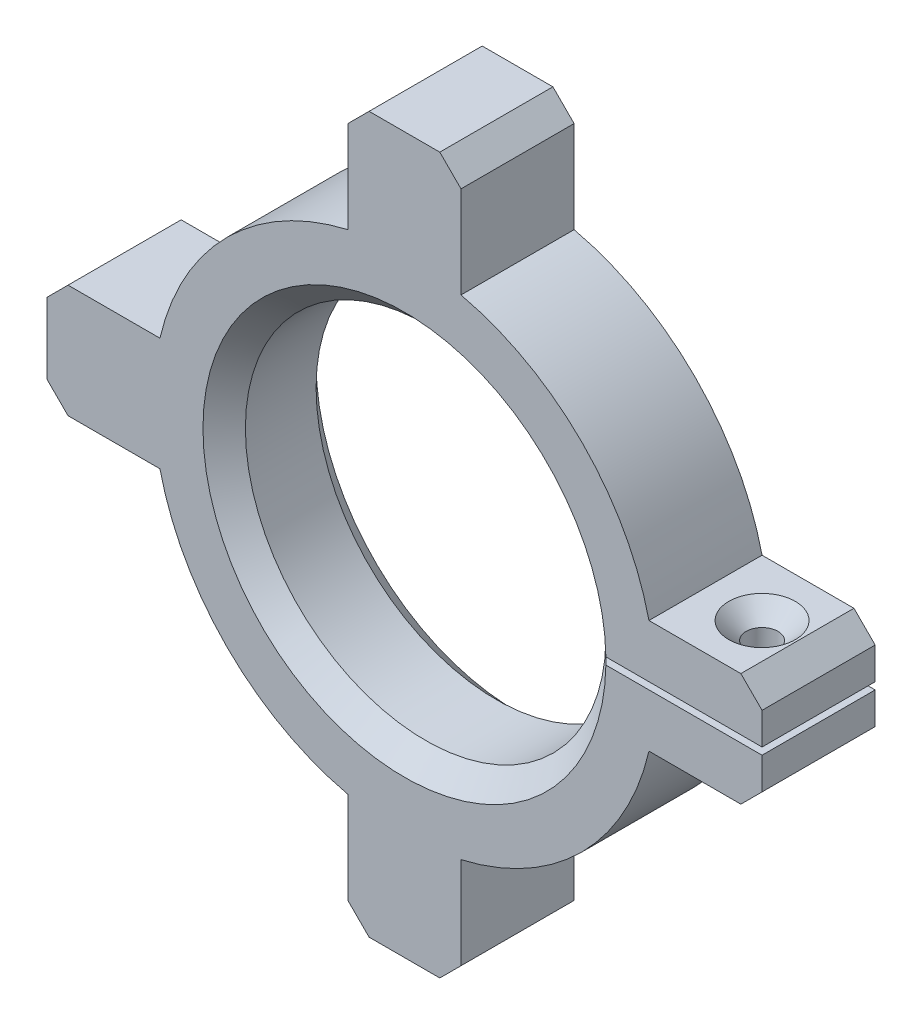
from build123d import *

# Parameters (mm, degrees)
EXTRUDE_1_DEPTH             = 8
HOLE_WIZARD_M41_D           = 4.5
HOLE_WIZARD_M41_CSINK_D     = 9.4
HOLE_WIZARD_M41_CSINK_ANGLE = 90
CUT_EXTRUDE_2_DEPTH         = 5
CHAMFER_1_SIZE              = 3


with BuildPart() as part:
    # Эскиз1 → Бобышка-Вытянуть1 (new, symmetric)
    with BuildSketch(Plane.XY):
        with BuildLine():
            Line((-8, 50.586847211), (8, 50.586847211))
            Line((8, 50.586847211), (8, 34.586847211))
            ThreePointArc((8, 34.586847211), (25.102290732, 25.102290732), (34.586847211, 8))
            Line((34.586847211, 8), (50.586847211, 8))
            Line((50.586847211, 8), (50.586847211, 0.5))
            Line((50.586847211, 0.5), (25.495097568, 0.5))
            ThreePointArc((25.495097568, 0.5), (-25.5, 0), (25.495097568, -0.5))
            Line((25.495097568, -0.5), (50.586847211, -0.5))
            Line((50.586847211, -0.5), (50.586847211, -8))
            Line((50.586847211, -8), (34.586847211, -8))
            ThreePointArc((34.586847211, -8), (25.102290732, -25.102290732), (8, -34.586847211))
            Line((8, -34.586847211), (8, -50.586847211))
            Line((8, -50.586847211), (-8, -50.586847211))
            Line((-8, -50.586847211), (-8, -34.586847211))
            ThreePointArc((-8, -34.586847211), (-25.102290732, -25.102290732), (-34.586847211, -8))
            Line((-34.586847211, -8), (-50.586847211, -8))
            Line((-50.586847211, -8), (-50.586847211, 8))
            Line((-50.586847211, 8), (-34.586847211, 8))
            ThreePointArc((-34.586847211, 8), (-25.102290732, 25.102290732), (-8, 34.586847211))
            Line((-8, 34.586847211), (-8, 50.586847211))
        make_face()
    extrude(amount=EXTRUDE_1_DEPTH, both=True)

    # Зенковка для винта с полупотайной головкой M41 (through all)
    with Locations(Plane(origin=(42.586847211, 8, 0), x_dir=(1, 0, 0), z_dir=(0, 1, 0))):
        with Locations((0, 0)):
            CounterSinkHole(HOLE_WIZARD_M41_D / 2, HOLE_WIZARD_M41_CSINK_D / 2, counter_sink_angle=HOLE_WIZARD_M41_CSINK_ANGLE)

    # Эскиз5 → Вырез-Вытянуть2 (cut)
    with BuildSketch(Plane.XZ.offset(8)):
        Polygon((46.91697423, 0), (44.751910721, 3.75), (40.421783702, 3.75), (38.256720192, 0), (40.421783702, -3.75), (44.751910721, -3.75), align=None)
    extrude(amount=-CUT_EXTRUDE_2_DEPTH, mode=Mode.SUBTRACT)

    # Фаска1
    chamfer_1_edges = [part.edges().sort_by_distance(p)[0] for p in [
        (-25.5, 0, -8),
        (50.586847211, -8, 0),
        (8, -50.586847211, 0),
        (-8, -50.586847211, 0),
        (-50.586847211, -8, 0),
        (-50.586847211, 8, 0),
        (-8, 50.586847211, 0),
        (8, 50.586847211, 0),
        (50.586847211, 8, 0),
        (-25.5, 0, 8),
    ]]
    chamfer(chamfer_1_edges, length=CHAMFER_1_SIZE)


solid = part.part
